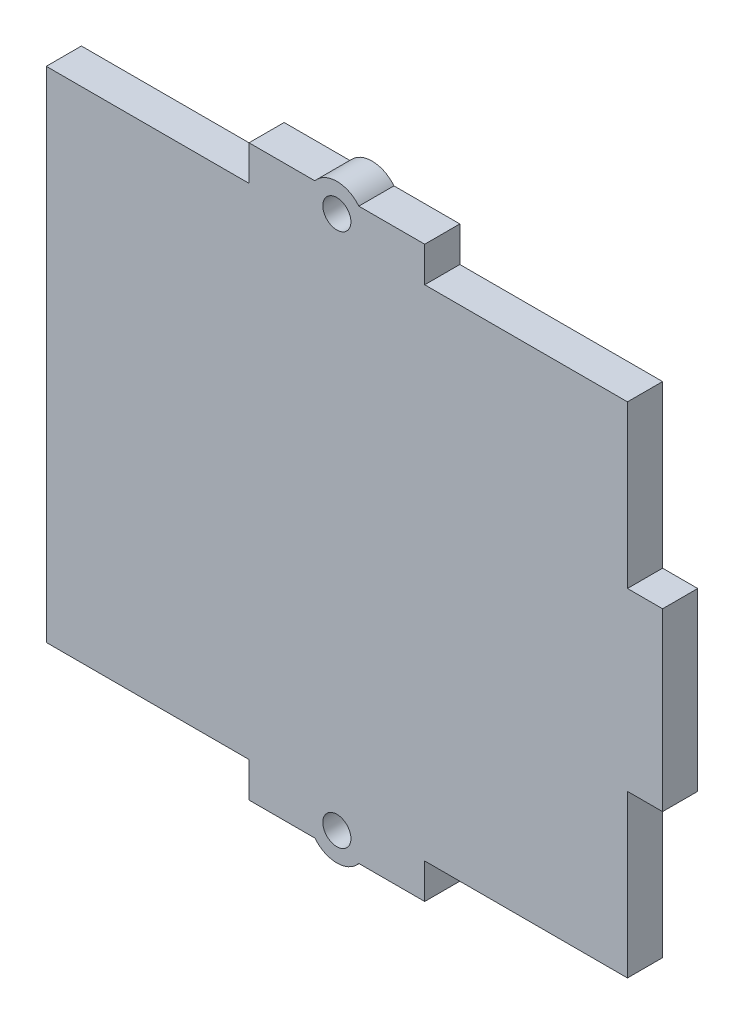
from build123d import *

# Parameters (mm, degrees)
SKETCH1_W           = 82.7
SKETCH1_H           = 71
BOSS_EXTRUDE1_DEPTH = 5
SKETCH3_W           = 25
SKETCH3_H           = 5
SKETCH3_W_2         = 5
SKETCH3_H_2         = 25
BOSS_EXTRUDE2_DEPTH = 5
SKETCH4_R           = 2
CUT_EXTRUDE1_DEPTH  = 5
SKETCH5_R           = 4
SKETCH5_R_2         = 2
BOSS_EXTRUDE3_DEPTH = 5


with BuildPart() as part:
    # Sketch1 → Boss-Extrude1 (new body)
    with BuildSketch(Plane.XY):
        Rectangle(SKETCH1_W, SKETCH1_H)
    extrude(amount=BOSS_EXTRUDE1_DEPTH)

    # Sketch3 → Boss-Extrude2 (add)
    with BuildSketch(Plane.XY.offset(5)):
        with Locations((0, 38)):
            Rectangle(SKETCH3_W, SKETCH3_H)
        with Locations((43.85, 0)):
            Rectangle(SKETCH3_W_2, SKETCH3_H_2)
        with Locations((0, -38)):
            Rectangle(SKETCH3_W, SKETCH3_H)
    extrude(amount=-BOSS_EXTRUDE2_DEPTH)

    # Sketch4 → Cut-Extrude1 (cut)
    with BuildSketch(Plane.XY.offset(5)):
        with Locations((0, 38)):
            Circle(SKETCH4_R)
        with Locations((0, -38)):
            Circle(SKETCH4_R)
    extrude(amount=-CUT_EXTRUDE1_DEPTH, mode=Mode.SUBTRACT)

    # Sketch5 → Boss-Extrude3 (add)
    # profile 1 of 2: a face of its own
    with BuildSketch(Plane.XY.offset(5)):
        with Locations((0, 38)):
            Circle(SKETCH5_R)
        with Locations((0, 38)):
            Circle(SKETCH5_R_2, mode=Mode.SUBTRACT)
    # profile 2 of 2: a face of its own
    with BuildSketch(Plane.XY.offset(5)):
        with Locations((0, -38)):
            Circle(SKETCH5_R)
        with Locations((0, -38)):
            Circle(SKETCH5_R_2, mode=Mode.SUBTRACT)
    extrude(amount=-BOSS_EXTRUDE3_DEPTH)


solid = part.part
